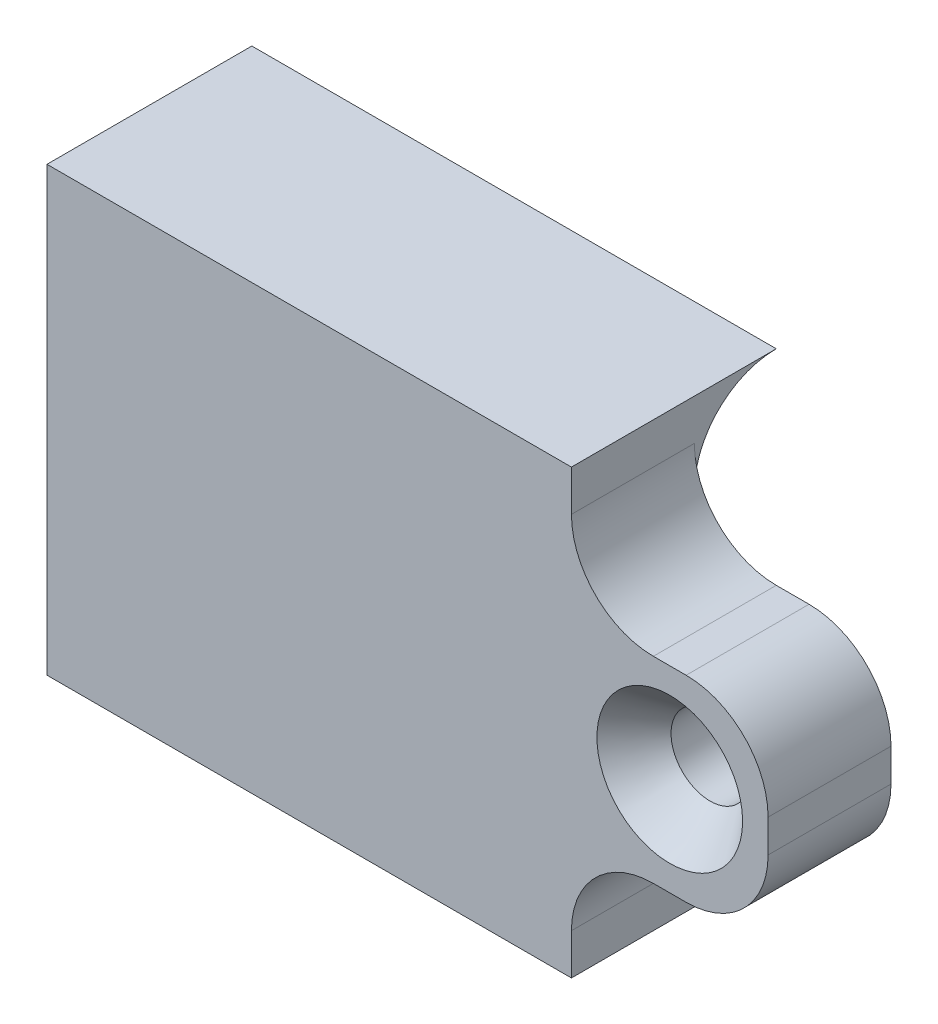
from build123d import *

# Parameters (mm, degrees)
SKETCH1_W                       = 12.8
SKETCH1_H                       = 10.8
SKETCH1_W_2                     = 4.8
SKETCH1_H_2                     = 4.8
BOSS_EXTRUDE1_DEPTH             = 1.5
F_2_CLEARANCE_HOLE1_D           = 1.905
F_2_CLEARANCE_HOLE1_CSINK_D     = 3.556
F_2_CLEARANCE_HOLE1_CSINK_ANGLE = 80
FILLET1_R                       = 2
BOSS_EXTRUDE2_REACH             = 14.524
BOSS_EXTRUDE2_DIRECTION_2_REACH = 14.524


with BuildPart() as part:
    # Sketch1 → Boss-Extrude1 (new, symmetric)
    with BuildSketch(Plane.XY):
        Rectangle(SKETCH1_W, SKETCH1_H)
        with Locations((8.8, 0)):
            Rectangle(SKETCH1_W_2, SKETCH1_H_2)
    extrude(amount=BOSS_EXTRUDE1_DEPTH, both=True)

    # #2 Clearance Hole1 (through all)
    with Locations(Plane.XY.offset(1.5)):
        with Locations((8.8, 0)):
            CounterSinkHole(F_2_CLEARANCE_HOLE1_D / 2, F_2_CLEARANCE_HOLE1_CSINK_D / 2, counter_sink_angle=F_2_CLEARANCE_HOLE1_CSINK_ANGLE)

    # Fillet1
    fillet1_edges = [part.edges().sort_by_distance(p)[0] for p in [
        (6.4, 2.4, 0),
        (11.2, 2.4, 0),
        (11.2, -2.4, 0),
        (6.4, -2.4, 0),
    ]]
    fillet(fillet1_edges, radius=FILLET1_R)

    # Boss-Extrude2: up to this face of the body (flat: up to its plane)
    boss_extrude2_end = Plane(part.part.faces().sort_by_distance((-6.4, 0, 0))[0])
    # Sketch4 → Boss-Extrude2 (add, up to the picked face)
    with BuildSketch(Plane(origin=(0, 0, 0), x_dir=(0, 0, -1), z_dir=(1, 0, 0)), mode=Mode.PRIVATE) as boss_extrude2_sk1:
        with BuildLine():
            Line((1.5, 5.4), (3.5, 5.4))
            ThreePointArc((3.5, 5.4), (2.085786438, 4.814213562), (1.5, 3.4))
            Line((1.5, 3.4), (1.5, 5.4))
        make_face()
    boss_extrude2_tool1 = split(extrude(boss_extrude2_sk1.sketch, amount=-BOSS_EXTRUDE2_REACH, mode=Mode.PRIVATE), bisect_by=boss_extrude2_end, keep=Keep.BOTH, mode=Mode.PRIVATE)
    # Sketch4 → Boss-Extrude2 (add, up to the picked face)
    with BuildSketch(Plane(origin=(0, 0, 0), x_dir=(0, 0, -1), z_dir=(1, 0, 0)), mode=Mode.PRIVATE) as boss_extrude2_sk2:
        with BuildLine():
            Line((1.5, -5.4), (1.5, -3.4))
            ThreePointArc((1.5, -3.4), (2.085786438, -4.814213562), (3.5, -5.4))
            Line((3.5, -5.4), (1.5, -5.4))
        make_face()
    boss_extrude2_tool2 = split(extrude(boss_extrude2_sk2.sketch, amount=-BOSS_EXTRUDE2_REACH, mode=Mode.PRIVATE), bisect_by=boss_extrude2_end, keep=Keep.BOTH, mode=Mode.PRIVATE)
    add(boss_extrude2_tool1.solids().sort_by(Axis((0, 4.953264, -1.946736), (-1, 0, 0)))[0])
    add(boss_extrude2_tool2.solids().sort_by(Axis((0, -4.953264, -1.946736), (-1, 0, 0)))[0])

    # Boss-Extrude2 direction 2: up to this face of the body (flat: up to its plane)
    boss_extrude2_direction_2_end = Plane(part.part.faces().sort_by_distance((6.4, 4.9, 0))[0])
    # Sketch4 → Boss-Extrude2 direction 2 (add, up to the picked face)
    with BuildSketch(Plane(origin=(0, 0, 0), x_dir=(0, 0, -1), z_dir=(1, 0, 0)), mode=Mode.PRIVATE) as boss_extrude2_direction_2_sk1:
        with BuildLine():
            Line((1.5, 5.4), (3.5, 5.4))
            ThreePointArc((3.5, 5.4), (2.085786438, 4.814213562), (1.5, 3.4))
            Line((1.5, 3.4), (1.5, 5.4))
        make_face()
    boss_extrude2_direction_2_tool1 = split(extrude(boss_extrude2_direction_2_sk1.sketch, amount=BOSS_EXTRUDE2_DIRECTION_2_REACH, mode=Mode.PRIVATE), bisect_by=boss_extrude2_direction_2_end, keep=Keep.BOTH, mode=Mode.PRIVATE)
    # Sketch4 → Boss-Extrude2 direction 2 (add, up to the picked face)
    with BuildSketch(Plane(origin=(0, 0, 0), x_dir=(0, 0, -1), z_dir=(1, 0, 0)), mode=Mode.PRIVATE) as boss_extrude2_direction_2_sk2:
        with BuildLine():
            Line((1.5, -5.4), (1.5, -3.4))
            ThreePointArc((1.5, -3.4), (2.085786438, -4.814213562), (3.5, -5.4))
            Line((3.5, -5.4), (1.5, -5.4))
        make_face()
    boss_extrude2_direction_2_tool2 = split(extrude(boss_extrude2_direction_2_sk2.sketch, amount=BOSS_EXTRUDE2_DIRECTION_2_REACH, mode=Mode.PRIVATE), bisect_by=boss_extrude2_direction_2_end, keep=Keep.BOTH, mode=Mode.PRIVATE)
    add(boss_extrude2_direction_2_tool1.solids().sort_by(Axis((0, 4.953264, -1.946736), (1, 0, 0)))[0])
    add(boss_extrude2_direction_2_tool2.solids().sort_by(Axis((0, -4.953264, -1.946736), (1, 0, 0)))[0])


solid = part.part
